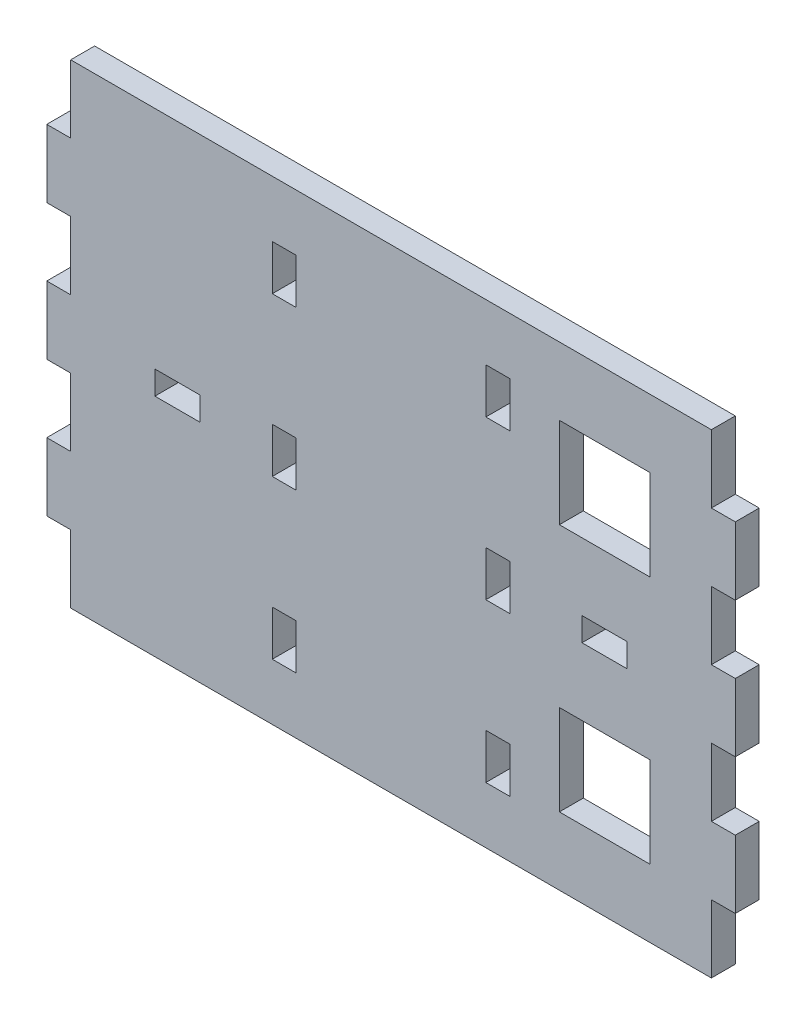
from build123d import *

# Parameters (mm, degrees)
SKETCH1_W           = 6
SKETCH1_H           = 3.125
SKETCH1_W_2         = 12
SKETCH1_H_2         = 12
SKETCH1_W_3         = 3.175
SKETCH1_H_3         = 6
BOSS_EXTRUDE1_DEPTH = 1.5875


with BuildPart() as part:
    # Sketch1 → Boss-Extrude1 (new, symmetric)
    with BuildSketch(Plane.XY):
        Polygon((45.675, 4.5), (42.5, 4.5), (42.5, 13.5), (45.675, 13.5), (45.675, 22.5), (42.5, 22.5), (42.5, 31.5), (-42.5, 31.5), (-42.5, 22.5), (-45.675, 22.5), (-45.675, 13.5), (-42.5, 13.5), (-42.5, 4.5), (-45.675, 4.5), (-45.675, -4.5), (-42.5, -4.5), (-42.5, -13.5), (-45.675, -13.5), (-45.675, -22.5), (-42.5, -22.5), (-42.5, -31.5), (42.5, -31.5), (42.5, -22.5), (45.675, -22.5), (45.675, -13.5), (42.5, -13.5), (42.5, -4.5), (45.675, -4.5), align=None)
        with Locations((28.333333333, 0)):
            Rectangle(SKETCH1_W, SKETCH1_H, mode=Mode.SUBTRACT)
        with Locations((28.333333333, 16.5)):
            Rectangle(SKETCH1_W_2, SKETCH1_H_2, mode=Mode.SUBTRACT)
        with Locations((28.333333333, -16.5)):
            Rectangle(SKETCH1_W_2, SKETCH1_H_2, mode=Mode.SUBTRACT)
        with Locations((14.166666667, 21)):
            Rectangle(SKETCH1_W_3, SKETCH1_H_3, mode=Mode.SUBTRACT)
        with Locations((-14.166666667, -21)):
            Rectangle(SKETCH1_W_3, SKETCH1_H_3, mode=Mode.SUBTRACT)
        with Locations((14.166666667, -21)):
            Rectangle(SKETCH1_W_3, SKETCH1_H_3, mode=Mode.SUBTRACT)
        with Locations((-28.333333333, 0)):
            Rectangle(SKETCH1_W, SKETCH1_H, mode=Mode.SUBTRACT)
        with Locations((-14.166666667, 0)):
            Rectangle(SKETCH1_W_3, SKETCH1_H_3, mode=Mode.SUBTRACT)
        with Locations((-14.166666667, 21)):
            Rectangle(SKETCH1_W_3, SKETCH1_H_3, mode=Mode.SUBTRACT)
        with Locations((14.166666667, 0)):
            Rectangle(SKETCH1_W_3, SKETCH1_H_3, mode=Mode.SUBTRACT)
    extrude(amount=BOSS_EXTRUDE1_DEPTH, both=True)


solid = part.part
